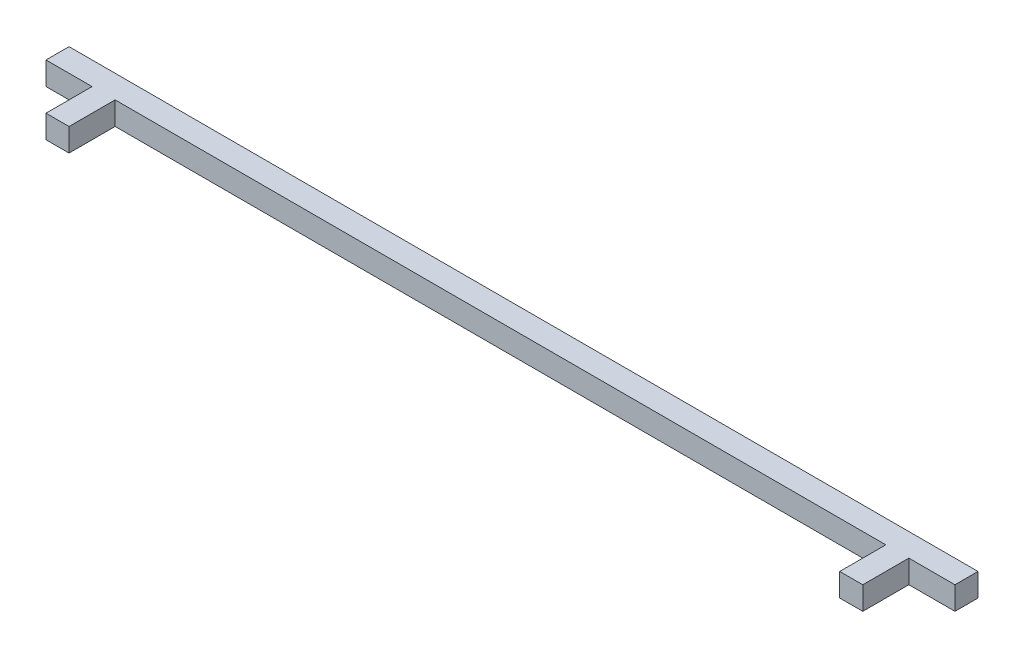
from build123d import *

# Parameters (mm, degrees)
BOSS_EXTRUDE2_DEPTH = 3


with BuildPart() as part:
    # Sketch1 → Boss-Extrude2 (new body)
    with BuildSketch(Plane(origin=(0, 0, 0), x_dir=(1, 0, 0), z_dir=(0, 1, 0))):
        Polygon((0, 0), (0, 3), (118.32, 3), (118.32, 0), (112.32, 0), (112.32, -6), (109.32, -6), (109.32, 0), (9, 0), (9, -6), (6, -6), (6, 0), align=None)
    extrude(amount=BOSS_EXTRUDE2_DEPTH)


solid = part.part
